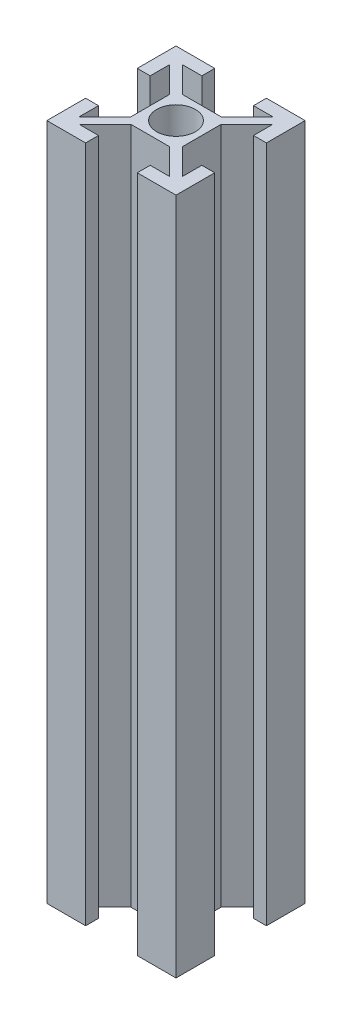
from build123d import *

# Parameters (mm, degrees)
F_2020_SKETCH_R     = 3
BOSS_EXTRUDE1_DEPTH = 105


with BuildPart() as part:
    # 2020 sketch → Boss-Extrude1 (new body)
    with BuildSketch(Plane(origin=(0, 0, 0), x_dir=(1, 0, 0), z_dir=(0, 1, 0))):
        Polygon((-4, 10), (-4, 8), (-7, 8), (-3, 4), (3, 4), (7, 8), (4, 8), (4, 10), (10, 10), (10, 4), (8, 4), (8, 7), (4, 3), (4, -3), (8, -7), (8, -4), (10, -4), (10, -10), (4, -10), (4, -8), (7, -8), (3, -4), (-3, -4), (-7, -8), (-4, -8), (-4, -10), (-10, -10), (-10, -4), (-8, -4), (-8, -7), (-4, -3), (-4, 3), (-8, 7), (-8, 4), (-10, 4), (-10, 10), align=None)
        with Locations(Location((0, 0, 0), (0, 0, 270))):
            Circle(F_2020_SKETCH_R, mode=Mode.SUBTRACT)
    extrude(amount=BOSS_EXTRUDE1_DEPTH)


solid = part.part
